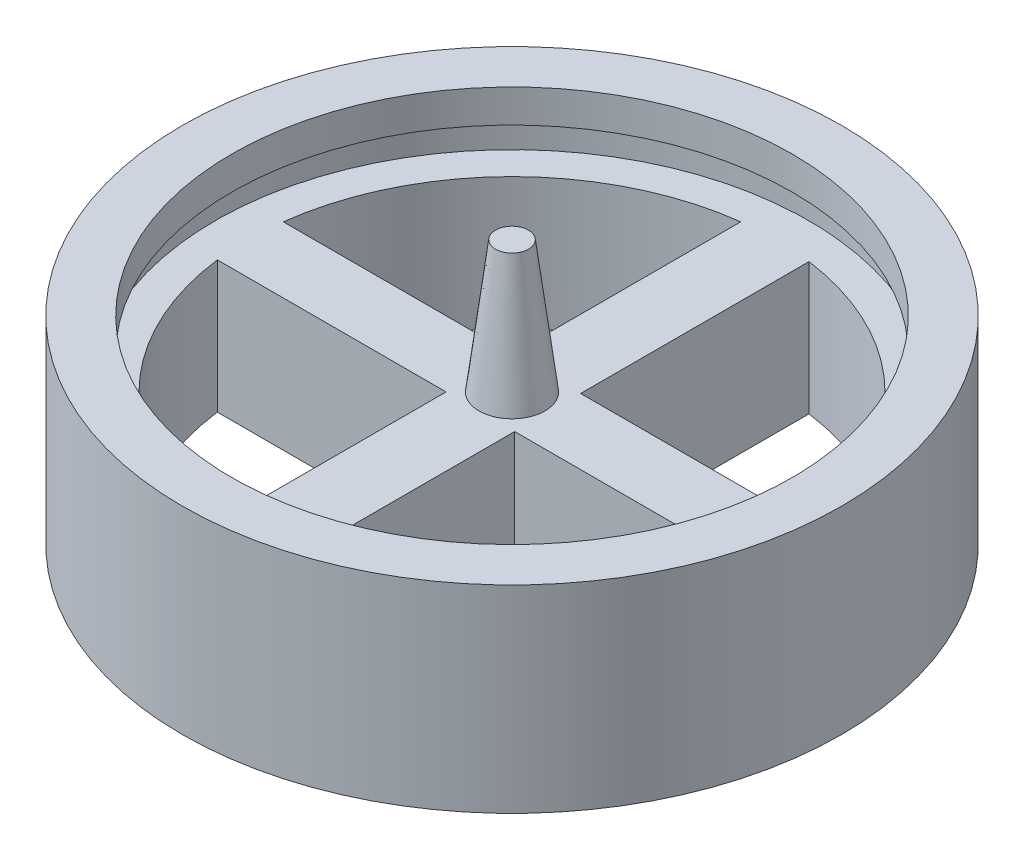
from build123d import *

# Parameters (mm, degrees)
SKETCH1_R           = 5
BOSS_EXTRUDE1_DEPTH = 3
CUT_EXTRUDE1_DEPTH  = 3
SKETCH3_R           = 4.5
CUT_EXTRUDE2_DEPTH  = 1
SKETCH27_W          = 0.25
SKETCH27_H          = 0.5


with BuildPart() as part:
    # Sketch1 → Boss-Extrude1 (new body)
    with BuildSketch(Plane(origin=(0, 0, 0), x_dir=(1, 0, 0), z_dir=(0, 1, 0))):
        with Locations(Location((0, 0, 0), (0, 0, 270))):
            Circle(SKETCH1_R)
    extrude(amount=BOSS_EXTRUDE1_DEPTH)

    # Sketch2 → Cut-Extrude1 (cut)
    with BuildSketch(Plane(origin=(0, 3, 0), x_dir=(1, 0, 0), z_dir=(0, 1, 0))):
        with BuildLine():
            ThreePointArc((3.968626967, 0.5), (2.842920112, 2.813859491), (0.540748653, 3.96328032))
            Line((0.540748653, 3.96328032), (0.540748653, 0.5))
            Line((0.540748653, 0.5), (3.968626967, 0.5))
        make_face()
        with BuildLine():
            Line((-0.5, 3.968626967), (-0.5, 0.5))
            Line((-0.5, 0.5), (-3.968626967, 0.5))
            ThreePointArc((-3.968626967, 0.5), (-2.828427125, 2.828427125), (-0.5, 3.968626967))
        make_face()
        with BuildLine():
            Line((-3.968626967, -0.5), (-0.5, -0.5))
            Line((-0.5, -0.5), (-0.5, -3.968626967))
            ThreePointArc((-0.5, -3.968626967), (-2.828427125, -2.828427125), (-3.968626967, -0.5))
        make_face()
        with BuildLine():
            Line((0.540748653, -3.96328032), (0.540748653, -0.5))
            Line((0.540748653, -0.5), (3.968626967, -0.5))
            ThreePointArc((3.968626967, -0.5), (2.842920112, -2.813859491), (0.540748653, -3.96328032))
        make_face()
    extrude(amount=-CUT_EXTRUDE1_DEPTH, mode=Mode.SUBTRACT)

    # Sketch3 → Cut-Extrude2 (cut)
    with BuildSketch(Plane(origin=(0, 3, 0), x_dir=(1, 0, 0), z_dir=(0, 1, 0))):
        with Locations(Location((0, 0, 0), (0, 0, 270))):
            Circle(SKETCH3_R)
    extrude(amount=-CUT_EXTRUDE2_DEPTH, mode=Mode.SUBTRACT)

    # Sketch22 → Revolve1 (revolve)
    with BuildSketch(Plane.XY, mode=Mode.PRIVATE) as revolve1_sk:
        Polygon((0, 4), (-0.25, 4), (-0.5, 2), (0, 2), align=None)
    revolve(revolve1_sk.sketch.rotate(Axis((0, 0, 0), (0, 1, 0)), 270), axis=Axis((0, 0, 0), (0, 1, 0)))

    # Sketch27 → Revolve2 (revolve)
    with BuildSketch(Plane.XY, mode=Mode.PRIVATE) as revolve2_sk:
        with Locations((-4.375, 2.75)):
            Rectangle(SKETCH27_W, SKETCH27_H)
    revolve(revolve2_sk.sketch.rotate(Axis((0, 2, 0), (0, 1, 0)), 90), axis=Axis((0, 2, 0), (0, 1, 0)))


solid = part.part
